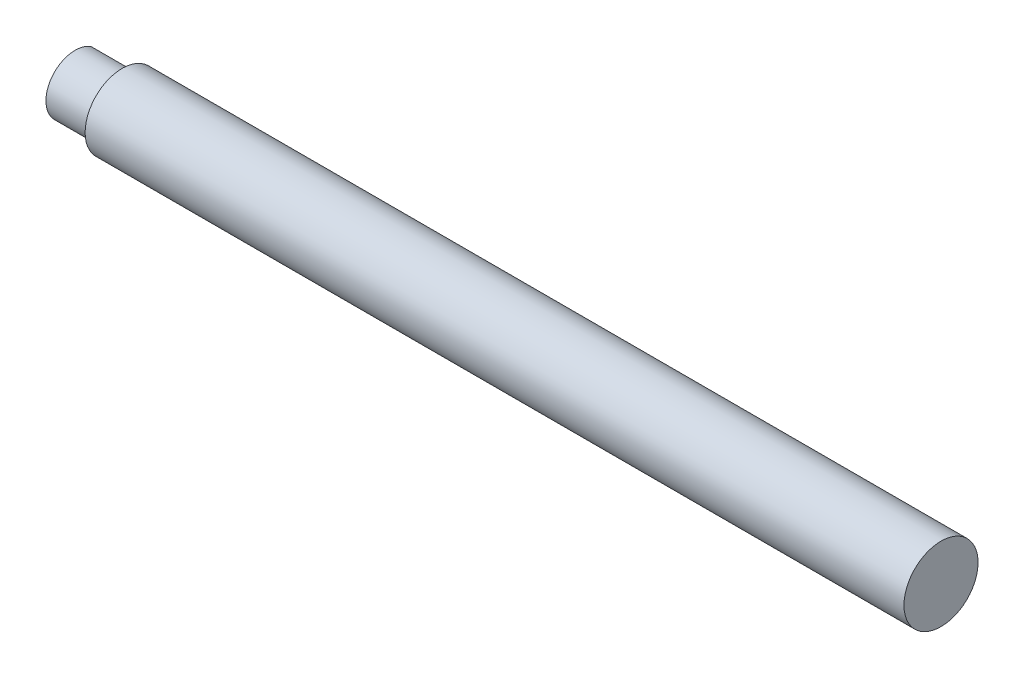
from build123d import *

# Parameters (mm, degrees)
SKETCH1_R          = 2.5
BASE_DEPTH         = 58.42
SKETCH2_OUTSIDE_W  = 18.77
SKETCH2_OUTSIDE_H  = 18.77
CUT_EXTRUDE1_DEPTH = 3.175


with BuildPart() as part:
    # Sketch1 → Base (new body)
    with BuildSketch(Plane(origin=(0, 0, 0), x_dir=(0, 0, -1), z_dir=(1, 0, 0))):
        with Locations(Location((0, 0, 0), (0, 0, 180))):
            Circle(SKETCH1_R)
    extrude(amount=BASE_DEPTH)

    # Sketch2 outside → Cut-Extrude1 (cut)
    with BuildSketch(Plane(origin=(0, 0, 0), x_dir=(0, 0, -1), z_dir=(1, 0, 0))):
        Rectangle(SKETCH2_OUTSIDE_W, SKETCH2_OUTSIDE_H)
        with BuildLine():
            Line((1.0795, 1.646108137), (1.0795, -1.646108137))
            ThreePointArc((1.0795, -1.646108137), (-1.9685, 0), (1.0795, 1.646108137))
        make_face(mode=Mode.SUBTRACT)
    extrude(amount=CUT_EXTRUDE1_DEPTH, mode=Mode.SUBTRACT)


solid = part.part
